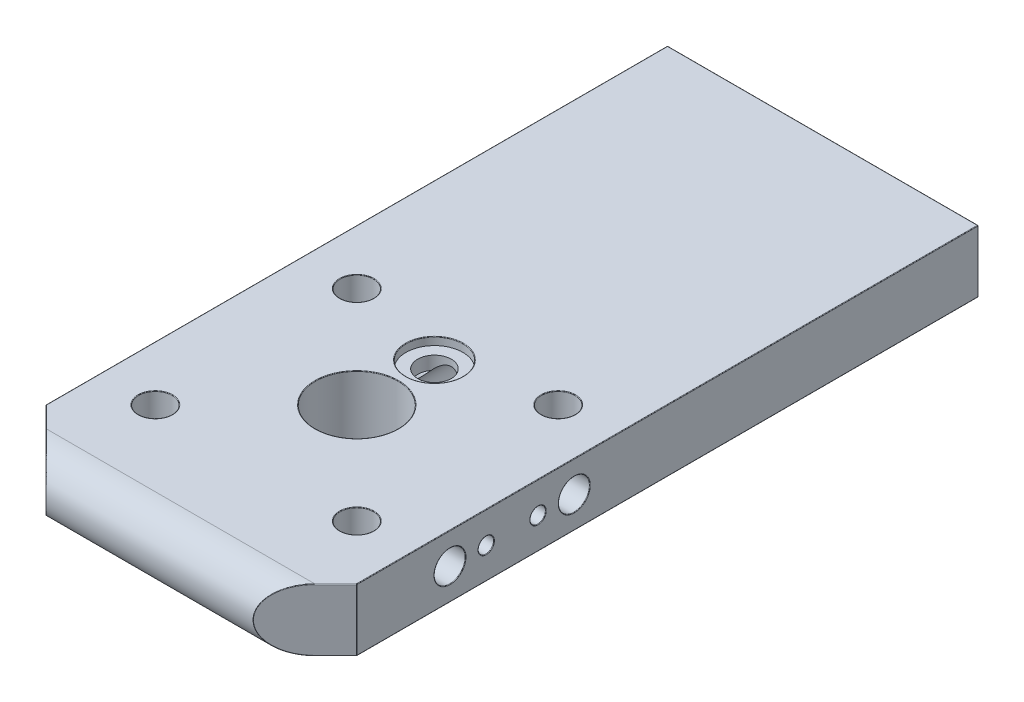
from build123d import *

# Parameters (mm, degrees)
SKETCH1_W                               = 60
SKETCH1_H                               = 130
SKETCH1_R                               = 8
SKETCH1_R_2                             = 3.25
BOSS_EXTRUDE1_DEPTH                     = 12
CHAMFER1_SIZE                           = 10
CUT_EXTRUDE1_DEPTH                      = 134.955216397
CUT_EXTRUDE1_DEPTH_BACK                 = 134.955216397
F_6_0MM_DOWEL_HOLE1_D                   = 6.5
F_6_0MM_DOWEL_HOLE1_DEPTH               = 78.5
F_6_0MM_DOWEL_HOLE1_TIP                 = 1.952797012
CBORE_FOR_M6_HEX_HEAD_BOLT1_D           = 6.5
CBORE_FOR_M6_HEX_HEAD_BOLT1_DEPTH       = 4.047202988
CBORE_FOR_M6_HEX_HEAD_BOLT1_CBORE_D     = 11
CBORE_FOR_M6_HEX_HEAD_BOLT1_CBORE_DEPTH = 1.5
CBORE_FOR_M6_HEX_HEAD_BOLT1_TIP         = 1.952797012
FILLET4_R                               = 0.1


with BuildPart() as part:
    # Sketch1 → Boss-Extrude1 (new body)
    with BuildSketch(Plane(origin=(0, 0, 0), x_dir=(1, 0, 0), z_dir=(0, 1, 0))):
        with Locations((30, -65)):
            Rectangle(SKETCH1_W, SKETCH1_H)
        with Locations(Location((30, -90, 0), (0, 0, 270))):
            Circle(SKETCH1_R, mode=Mode.SUBTRACT)
        with Locations(Location((49.445436483, -70.554563517, 0), (0, 0, 270))):
            Circle(SKETCH1_R_2, mode=Mode.SUBTRACT)
        with Locations(Location((49.445436483, -109.445436483, 0), (0, 0, 270))):
            Circle(SKETCH1_R_2, mode=Mode.SUBTRACT)
        with Locations(Location((10.554563517, -109.445436483, 0), (0, 0, 270))):
            Circle(SKETCH1_R_2, mode=Mode.SUBTRACT)
        with Locations(Location((10.554563517, -70.554563517, 0), (0, 0, 270))):
            Circle(SKETCH1_R_2, mode=Mode.SUBTRACT)
    extrude(amount=-BOSS_EXTRUDE1_DEPTH)

    # Chamfer1
    chamfer1_edges = [part.edges().sort_by_distance(p)[0] for p in [
        (60, -6, 130),
        (0, -6, 130),
    ]]
    chamfer(chamfer1_edges, length=CHAMFER1_SIZE)

    # Sketch2 → Cut-Extrude1 (cut, two sides: drawn at the far end of the back side and taken through both)
    with BuildSketch(Plane.ZY.offset(-30).offset(-CUT_EXTRUDE1_DEPTH_BACK)):
        with BuildLine():
            Line((130, 0), (124, 0))
            ThreePointArc((124, 0), (128.242640687, -1.757359313), (130, -6))
            Line((130, -6), (130, 0))
        make_face()
        with BuildLine():
            ThreePointArc((130, -6), (128.242640687, -10.242640687), (124, -12))
            Line((124, -12), (130, -12))
            Line((130, -12), (130, -6))
        make_face()
    extrude(amount=CUT_EXTRUDE1_DEPTH + CUT_EXTRUDE1_DEPTH_BACK, mode=Mode.SUBTRACT)

    # Sketch5 → M6x1.0 Tapped Hole1 (revolve, cut)
    with BuildSketch(Plane(origin=(50, -6, 0), x_dir=(0, 1, 0), z_dir=(1, 0, 0))):
        Polygon((0, 0), (0, 20), (2.5, 18.497848452), (2.5, 15), (3, 15), (3, 0), align=None)
    m6x1_0_tapped_hole1 = revolve(axis=Axis((50, -6, -6.35), (0, 0, 1)), mode=Mode.SUBTRACT)

    # Sketch8 → Ø5.0mm Dowel Hole1 (revolve, cut)
    with BuildSketch(Plane(origin=(40, -6, 0), x_dir=(0, 1, 0), z_dir=(1, 0, 0))):
        Polygon((0, 0), (0, 16.502151548), (2.5, 15), (2.5, 0), align=None)
    f_5_0mm_dowel_hole1 = revolve(axis=Axis((40, -6, -6.35), (0, 0, 1)), mode=Mode.SUBTRACT)

    # Mirror1: M6x1.0 Tapped Hole1, Ø5.0mm Dowel Hole1 across plane
    add(m6x1_0_tapped_hole1.mirror(Plane.ZY.offset(-30)), mode=Mode.SUBTRACT)
    add(f_5_0mm_dowel_hole1.mirror(Plane.ZY.offset(-30)), mode=Mode.SUBTRACT)

    # Ø6.0mm Dowel Hole1
    with Locations(Plane(origin=(0, 0, 0), x_dir=(-1, 0, 0), z_dir=(0, 0, -1))):
        with Locations((-30, -6)):
            Hole(F_6_0MM_DOWEL_HOLE1_D / 2, depth=F_6_0MM_DOWEL_HOLE1_DEPTH)
            with Locations((0, 0, -(F_6_0MM_DOWEL_HOLE1_DEPTH + F_6_0MM_DOWEL_HOLE1_TIP / 2))):  # 118° drill point
                Cone(0, F_6_0MM_DOWEL_HOLE1_D / 2, F_6_0MM_DOWEL_HOLE1_TIP, mode=Mode.SUBTRACT)

    # Sketch13 → Ø3.0mm Dowel Hole1 (revolve, cut)
    with BuildSketch(Plane(origin=(60, -6, 85), x_dir=(0, 0, -1), z_dir=(0, 1, 0))):
        Polygon((0, 0), (0, 12), (1.5, 11.098709071), (1.5, 0), align=None)
    f_3_0mm_dowel_hole1 = revolve(axis=Axis((66.35, -6, 85), (-1, 0, 0)), mode=Mode.SUBTRACT)

    # Sketch15 → M6x1.0 Tapped Hole2 (revolve, cut)
    with BuildSketch(Plane(origin=(60, -6, 78), x_dir=(0, 0, -1), z_dir=(0, 1, 0))):
        Polygon((0, 0), (0, 20), (2.5, 18.497848452), (2.5, 15), (3, 15), (3, 0), align=None)
    m6x1_0_tapped_hole2 = revolve(axis=Axis((66.35, -6, 78), (-1, 0, 0)), mode=Mode.SUBTRACT)

    # Mirror2: Ø3.0mm Dowel Hole1, M6x1.0 Tapped Hole2 across plane
    add(f_3_0mm_dowel_hole1.mirror(Plane.XY.offset(90)), mode=Mode.SUBTRACT)
    add(m6x1_0_tapped_hole2.mirror(Plane.XY.offset(90)), mode=Mode.SUBTRACT)

    # CBORE for M6 Hex Head Bolt1
    with Locations(Plane(origin=(0, 0, 0), x_dir=(1, 0, 0), z_dir=(0, 1, 0))):
        with Locations((30, -75)):
            CounterBoreHole(CBORE_FOR_M6_HEX_HEAD_BOLT1_D / 2, CBORE_FOR_M6_HEX_HEAD_BOLT1_CBORE_D / 2, CBORE_FOR_M6_HEX_HEAD_BOLT1_CBORE_DEPTH, depth=CBORE_FOR_M6_HEX_HEAD_BOLT1_DEPTH)
            with Locations((0, 0, -(CBORE_FOR_M6_HEX_HEAD_BOLT1_DEPTH + CBORE_FOR_M6_HEX_HEAD_BOLT1_TIP / 2))):  # 118° drill point
                Cone(0, CBORE_FOR_M6_HEX_HEAD_BOLT1_D / 2, CBORE_FOR_M6_HEX_HEAD_BOLT1_TIP, mode=Mode.SUBTRACT)

    # Fillet4
    fillet4_edges = [part.edges().sort_by_distance(p)[0] for p in [
        (20, -8.5, 0),
        (26.75, -6, 0),
        (60, -6, 86.5),
        (60, -6, 81),
        (60, -6, 93.5),
        (30, -12, 82),
        (60, -6, 99),
        (30, 0, 82),
        (24.5, 0, 75),
        (49.445436483, -12, 67.304563517),
        (49.445436483, 0, 67.304563517),
        (30, -12, 0),
        (49.445436483, -12, 106.195436483),
        (49.445436483, 0, 106.195436483),
        (10.554563517, -12, 106.195436483),
        (10.554563517, 0, 106.195436483),
        (10.554563517, -12, 67.304563517),
        (10.554563517, 0, 67.304563517),
        (60, 0, 60),
        (2, 0, 122),
        (60, -12, 60),
        (60, -6, 120),
        (58, -12, 122),
        (0, -6, 120),
        (7.876293445, -1.420223899, 127.876293445),
        (58, 0, 122),
        (0, -12, 60),
        (30, 0, 0),
        (52.123706555, -10.579776101, 127.876293445),
        (0, 0, 60),
        (2, -12, 122),
        (0, -6, 0),
        (60, -6, 0),
        (50, -9, 0),
        (40, -8.5, 0),
        (10, -9, 0),
    ]]
    fillet(fillet4_edges, radius=FILLET4_R)


solid = part.part
